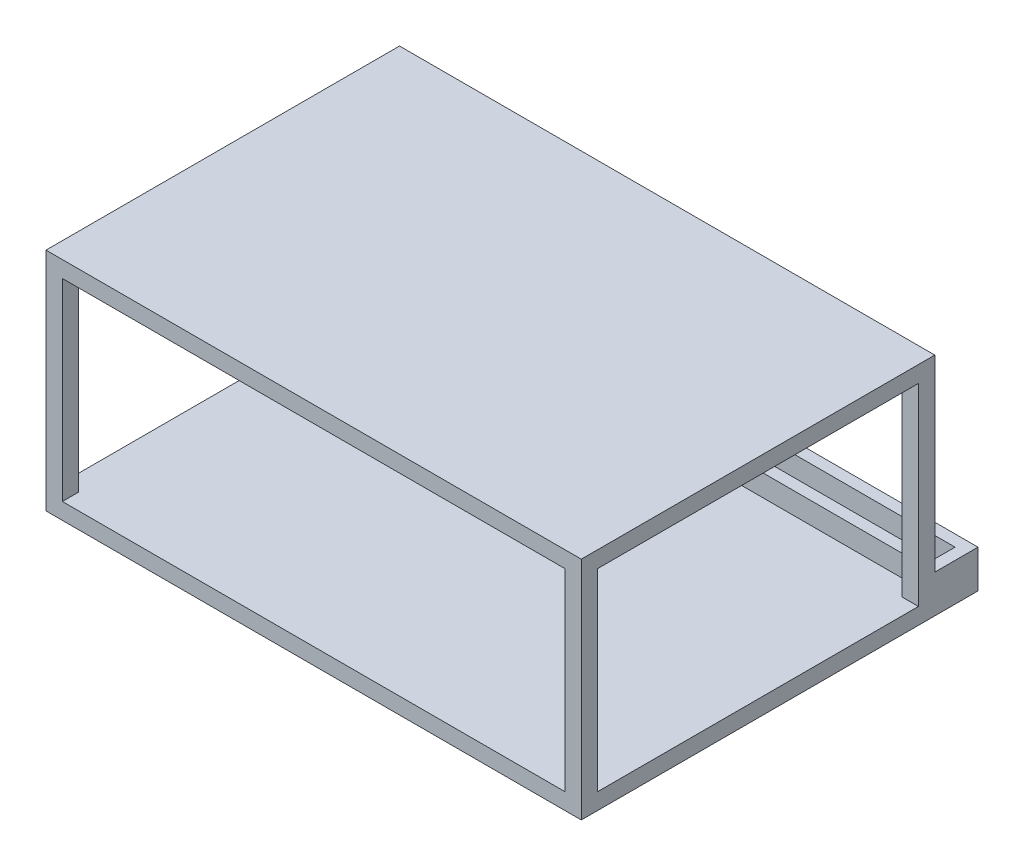
from build123d import *

# Parameters (mm, degrees)
SKETCH1_W           = 327.074
SKETCH1_H           = 26.4
SKETCH1_W_2         = 313.074
SKETCH1_H_2         = 12.4
BOSS_EXTRUDE1_DEPTH = 20
SKETCH2_W           = 327.074
SKETCH2_H           = 242.4
BOSS_EXTRUDE2_DEPTH = 3.175
SKETCH3_W           = 327.074
SKETCH3_H           = 216
BOSS_EXTRUDE3_DEPTH = 134.85
CUT_EXTRUDE1_REACH  = 400.252
CUT_EXTRUDE2_REACH  = 398.452
SKETCH5_W           = 307.074
SKETCH5_H           = 118.025


with BuildPart() as part:
    # Sketch1 → Boss-Extrude1 (new body)
    with BuildSketch(Plane(origin=(0, 0, 0), x_dir=(1, 0, 0), z_dir=(0, 1, 0))):
        with Locations((-119.715833623, 46.325831873)):
            Rectangle(SKETCH1_W, SKETCH1_H)
        with Locations((-119.715833623, 46.325831873)):
            Rectangle(SKETCH1_W_2, SKETCH1_H_2, mode=Mode.SUBTRACT)
    extrude(amount=BOSS_EXTRUDE1_DEPTH)

    # Sketch2 → Boss-Extrude2 (add)
    with BuildSketch(Plane.XZ):
        with Locations((-119.715833623, 61.674168127)):
            Rectangle(SKETCH2_W, SKETCH2_H)
    extrude(amount=BOSS_EXTRUDE2_DEPTH)

    # Sketch3 → Boss-Extrude3 (add)
    with BuildSketch(Plane(origin=(0, 0, 0), x_dir=(1, 0, 0), z_dir=(0, 1, 0))):
        with Locations((-119.715833623, -74.874168127)):
            Rectangle(SKETCH3_W, SKETCH3_H)
    extrude(amount=BOSS_EXTRUDE3_DEPTH)

    # Sketch4 → Cut-Extrude1 (cut, up to next)
    with BuildSketch(Plane.ZY.offset(283.252833623), mode=Mode.PRIVATE) as cut_extrude1_sk1:
        Polygon((-23.125831873, 10), (-23.125831873, 6.825), (172.874168127, 6.825), (172.874168127, 124.85), (-23.125831873, 124.85), align=None)
    cut_extrude1_tool1 = extrude(cut_extrude1_sk1.sketch, amount=-CUT_EXTRUDE1_REACH, mode=Mode.PRIVATE) & part.part
    add(cut_extrude1_tool1.solids().sort_by_distance((-283.252834, 65.8375, 74.874168))[0], mode=Mode.SUBTRACT)

    # Cut-Extrude2: up to this face of the body (flat: up to its plane)
    cut_extrude2_end = Plane(part.part.faces().sort_by_distance((-119.715833623, 77.425, -33.125831873))[0])
    # Sketch5 → Cut-Extrude2 (cut, up to the picked face)
    with BuildSketch(Plane.XY.offset(182.874168127), mode=Mode.PRIVATE) as cut_extrude2_sk1:
        with Locations((-119.715833623, 65.8375)):
            Rectangle(SKETCH5_W, SKETCH5_H)
    cut_extrude2_tool1 = split(extrude(cut_extrude2_sk1.sketch, amount=-CUT_EXTRUDE2_REACH, mode=Mode.PRIVATE), bisect_by=cut_extrude2_end, keep=Keep.BOTH, mode=Mode.PRIVATE)
    add(cut_extrude2_tool1.solids().sort_by(Axis((-119.715834, 65.8375, 182.874168), (0, 0, -1)))[0], mode=Mode.SUBTRACT)


solid = part.part
